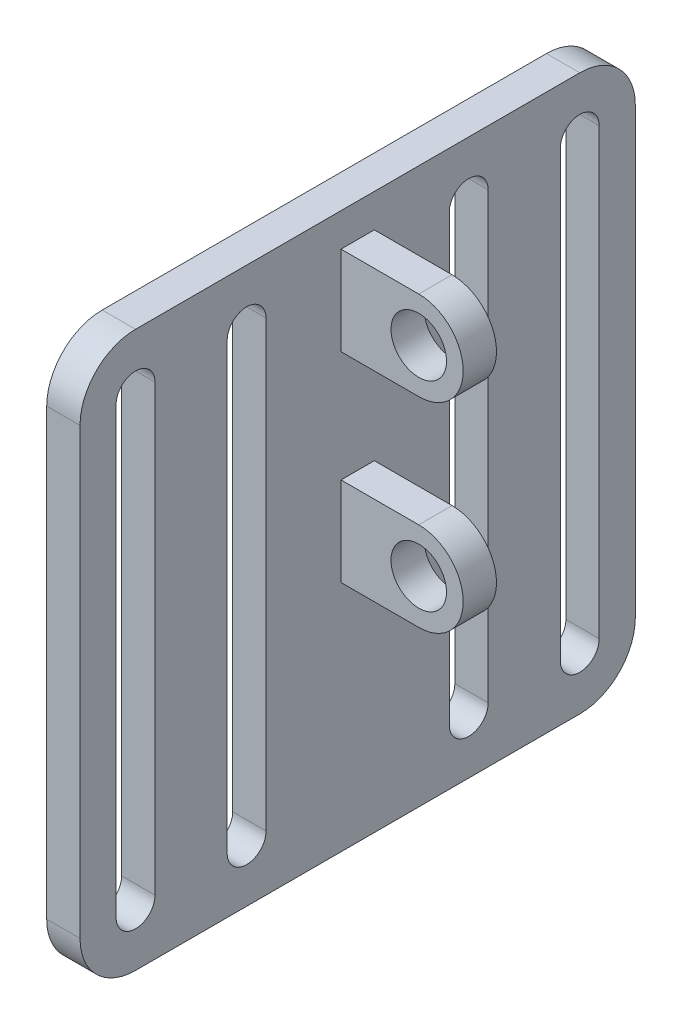
from build123d import *

# Parameters (mm, degrees)
SKETCH_1_W      = 50
SKETCH_1_H      = 50
SKETCH_1_R      = 1.75
EXTRUDE_1_DEPTH = 3
SKETCH_2_R      = 4
SKETCH_2_R_2    = 2.5
EXTRUDE_2_DEPTH = 1.5
FILLET_1_R      = 5


with BuildPart() as part:
    # 草图1 → 凸台-拉伸1 (new body)
    # profile 1 of 4: a face of its own
    with BuildSketch(Plane(origin=(0, 0, 0), x_dir=(0, 0, -1), z_dir=(1, 0, 0))):
        Rectangle(SKETCH_1_W, SKETCH_1_H)
        with BuildLine():
            Line((-21.75, -20), (-21.75, 20))
            ThreePointArc((-21.75, 20), (-20, 21.75), (-18.25, 20))
            Line((-18.25, 20), (-18.25, -20))
            ThreePointArc((-18.25, -20), (-20, -21.75), (-21.75, -20))
        make_face(mode=Mode.SUBTRACT)
        with BuildLine():
            Line((-11.75, -20), (-11.75, 20))
            ThreePointArc((-11.75, 20), (-10, 21.75), (-8.25, 20))
            Line((-8.25, 20), (-8.25, -20))
            ThreePointArc((-8.25, -20), (-10, -21.75), (-11.75, -20))
        make_face(mode=Mode.SUBTRACT)
        with BuildLine():
            Line((-1.75, -20), (-1.75, 20))
            ThreePointArc((-1.75, 20), (0, 21.75), (1.75, 20))
            Line((1.75, 20), (1.75, -20))
            ThreePointArc((1.75, -20), (0, -21.75), (-1.75, -20))
        make_face(mode=Mode.SUBTRACT)
        with BuildLine():
            Line((8.25, -20), (8.25, 20))
            ThreePointArc((8.25, 20), (10, 21.75), (11.75, 20))
            Line((11.75, 20), (11.75, -20))
            ThreePointArc((11.75, -20), (10, -21.75), (8.25, -20))
        make_face(mode=Mode.SUBTRACT)
        with BuildLine():
            Line((18.25, -20), (18.25, 20))
            ThreePointArc((18.25, 20), (20, 21.75), (21.75, 20))
            Line((21.75, 20), (21.75, -20))
            ThreePointArc((21.75, -20), (20, -21.75), (18.25, -20))
        make_face(mode=Mode.SUBTRACT)
    # profile 2 of 4: a face of its own
    with BuildSketch(Plane(origin=(0, 0, 0), x_dir=(0, 0, -1), z_dir=(1, 0, 0))):
        with BuildLine():
            ThreePointArc((1.75, 20), (0, 18.25), (-1.75, 20))
            Line((-1.75, 20), (-1.75, -20))
            ThreePointArc((-1.75, -20), (0, -18.25), (1.75, -20))
            Line((1.75, -20), (1.75, 20))
        make_face()
    # profile 3 of 4: a face of its own
    with BuildSketch(Plane(origin=(0, 0, 0), x_dir=(0, 0, -1), z_dir=(1, 0, 0))):
        with Locations((0, 20)):
            Circle(SKETCH_1_R)
    # profile 4 of 4: a face of its own
    with BuildSketch(Plane(origin=(0, 0, 0), x_dir=(0, 0, -1), z_dir=(1, 0, 0))):
        with Locations((0, -20)):
            Circle(SKETCH_1_R)
    extrude(amount=EXTRUDE_1_DEPTH)

    # 草图2 → 凸台-拉伸2 (add, symmetric)
    # profile 1 of 4: a face of its own
    with BuildSketch(Plane.XY):
        with BuildLine():
            Line((0, 14), (10, 14))
            ThreePointArc((10, 14), (6, 18), (10, 22))
            Line((10, 22), (0, 22))
            Line((0, 22), (0, 14))
        make_face()
    # profile 2 of 4: a face of its own
    with BuildSketch(Plane.XY):
        with Locations((10, 18)):
            Circle(SKETCH_2_R)
        with Locations((10, 18)):
            Circle(SKETCH_2_R_2, mode=Mode.SUBTRACT)
    # profile 3 of 4: a face of its own
    with BuildSketch(Plane.XY):
        with Locations((10, 0)):
            Circle(SKETCH_2_R)
        with Locations((10, 0)):
            Circle(SKETCH_2_R_2, mode=Mode.SUBTRACT)
    # profile 4 of 4: a face of its own
    with BuildSketch(Plane.XY):
        with BuildLine():
            Line((0, -4), (10, -4))
            ThreePointArc((10, -4), (6, 0), (10, 4))
            Line((10, 4), (0, 4))
            Line((0, 4), (0, -4))
        make_face()
    extrude(amount=EXTRUDE_2_DEPTH, both=True)

    # 圆角1
    fillet_1_edges = [part.edges().sort_by_distance(p)[0] for p in [
        (1.5, -25, -25),
        (1.5, -25, 25),
        (1.5, 25, 25),
        (1.5, 25, -25),
    ]]
    fillet(fillet_1_edges, radius=FILLET_1_R)


solid = part.part
